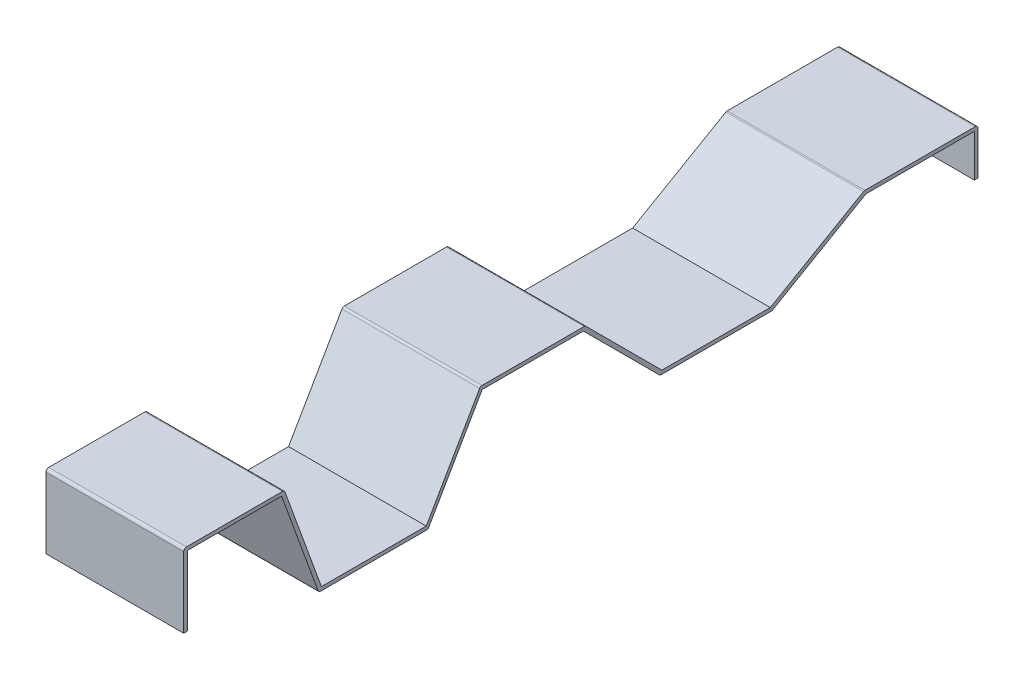
from build123d import *

# Parameters (mm, degrees)
BOSS_EXTRUDE1_DEPTH = 76.2
FILLET1_R           = 1.5
FILLET2_R           = 1.5
FILLET3_R           = 0.5


with BuildPart() as part:
    # Sketch1 → Boss-Extrude1 (new body)
    with BuildSketch(Plane(origin=(0, 0, 0), x_dir=(0, 0, -1), z_dir=(1, 0, 0))):
        Polygon((410.975974775, -727.738016425), (410.975974775, -702.338016425), (347.983974775, -702.338016425), (296.022450548, -732.338016425), (236.022450548, -732.338016425), (193.596043677, -689.911609554), (135.596043677, -689.911609554), (105.596043677, -741.873133781), (47.596043677, -741.873133781), (27.074835078, -685.491576534), (-28.635164922, -685.491576534), (-28.635164922, -726.131576534), (-26.635164922, -726.131576534), (-26.635164922, -687.491576534), (25.566835078, -687.491576534), (46.088043677, -743.873133781), (106.588043677, -743.873133781), (136.588043677, -691.911609554), (192.588043677, -691.911609554), (235.014450548, -734.338016425), (297.014450548, -734.338016425), (348.975974775, -704.338016425), (408.975974775, -704.338016425), (408.975974775, -727.738016425), align=None)
    extrude(amount=BOSS_EXTRUDE1_DEPTH)

    # Fillet1
    fillet1_edges = [part.edges().sort_by_distance(p)[0] for p in [
        (38.1, -685.491576534, 28.635164922),
        (38.1, -685.491576534, -27.074835078),
        (38.1, -689.911609554, -135.596043677),
        (38.1, -689.911609554, -193.596043677),
        (38.1, -702.338016425, -347.983974775),
        (38.1, -702.338016425, -410.975974775),
    ]]
    fillet(fillet1_edges, radius=FILLET1_R)

    # Fillet2
    fillet2_edges = [part.edges().sort_by_distance(p)[0] for p in [
        (38.1, -734.338016425, -297.014450548),
        (38.1, -734.338016425, -235.014450548),
        (38.1, -743.873133781, -106.588043677),
        (38.1, -743.873133781, -46.088043677),
    ]]
    fillet(fillet2_edges, radius=FILLET2_R)

    # Fillet3
    fillet3_edges = [part.edges().sort_by_distance(p)[0] for p in [
        (38.1, -704.338016425, -408.975974775),
        (38.1, -704.338016425, -348.975974775),
        (38.1, -691.911609554, -192.588043677),
        (38.1, -691.911609554, -136.588043677),
        (38.1, -687.491576534, -25.566835078),
        (38.1, -687.491576534, 26.635164922),
    ]]
    fillet(fillet3_edges, radius=FILLET3_R)


solid = part.part
